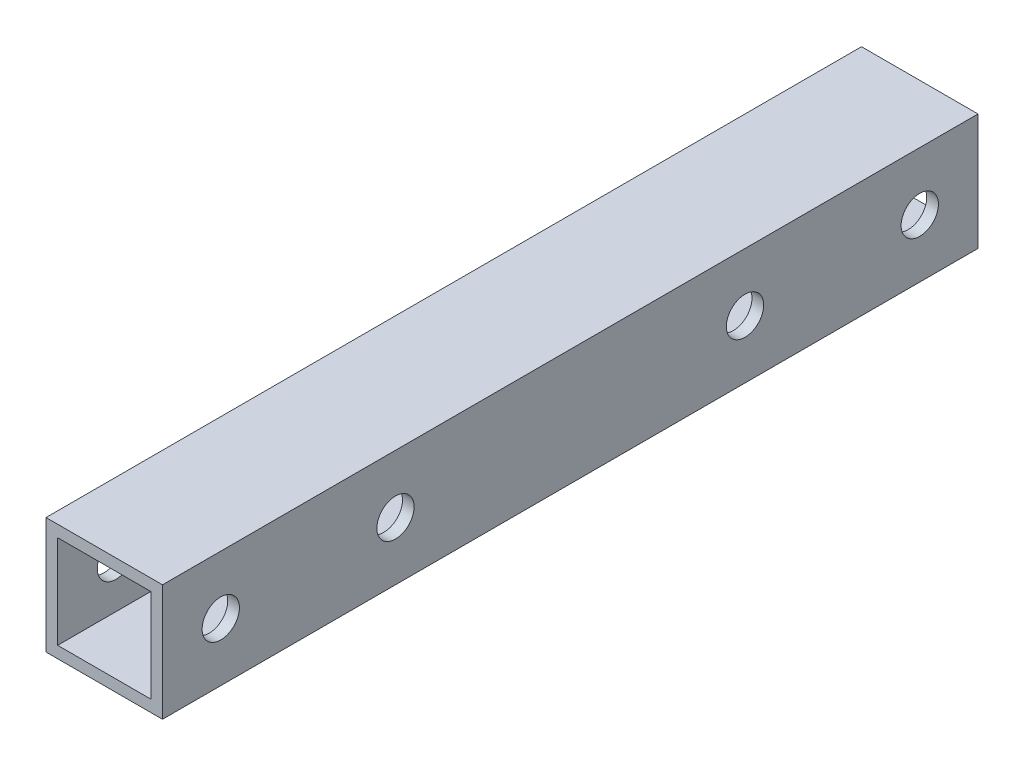
from build123d import *

# Parameters (mm, degrees)
SKETCH_1_W          = 10
SKETCH_1_H          = 10
SKETCH_1_W_2        = 8
SKETCH_1_H_2        = 8
EXTRUDE_1_DEPTH     = 70
SKETCH_2_R          = 1.6
CUT_EXTRUDE_1_DEPTH = 71.887234394
SKETCH_3_R          = 1.6
CUT_EXTRUDE_2_DEPTH = 71.887234394


with BuildPart() as part:
    # ｽｹｯﾁ1 → 押し出し-薄板1 (new body)
    with BuildSketch(Plane.XY):
        Rectangle(SKETCH_1_W, SKETCH_1_H)
        Rectangle(SKETCH_1_W_2, SKETCH_1_H_2, mode=Mode.SUBTRACT)
    extrude(amount=EXTRUDE_1_DEPTH)

    # ｽｹｯﾁ2 → ｶｯﾄ - 押し出し1 (cut, through all)
    with BuildSketch(Plane(origin=(5, 0, 0), x_dir=(0, 0, -1), z_dir=(1, 0, 0))):
        with Locations((-65, 0)):
            Circle(SKETCH_2_R)
        with Locations((-5, 0)):
            Circle(SKETCH_2_R)
        with Locations((-20, 0)):
            Circle(SKETCH_2_R)
    extrude(amount=-CUT_EXTRUDE_1_DEPTH, mode=Mode.SUBTRACT)

    # ｽｹｯﾁ3 → ｶｯﾄ - 押し出し2 (cut, through all)
    with BuildSketch(Plane(origin=(5, 0, 0), x_dir=(0, 0, -1), z_dir=(1, 0, 0))):
        with Locations((-50, 0)):
            Circle(SKETCH_3_R)
    extrude(amount=-CUT_EXTRUDE_2_DEPTH, mode=Mode.SUBTRACT)


solid = part.part
